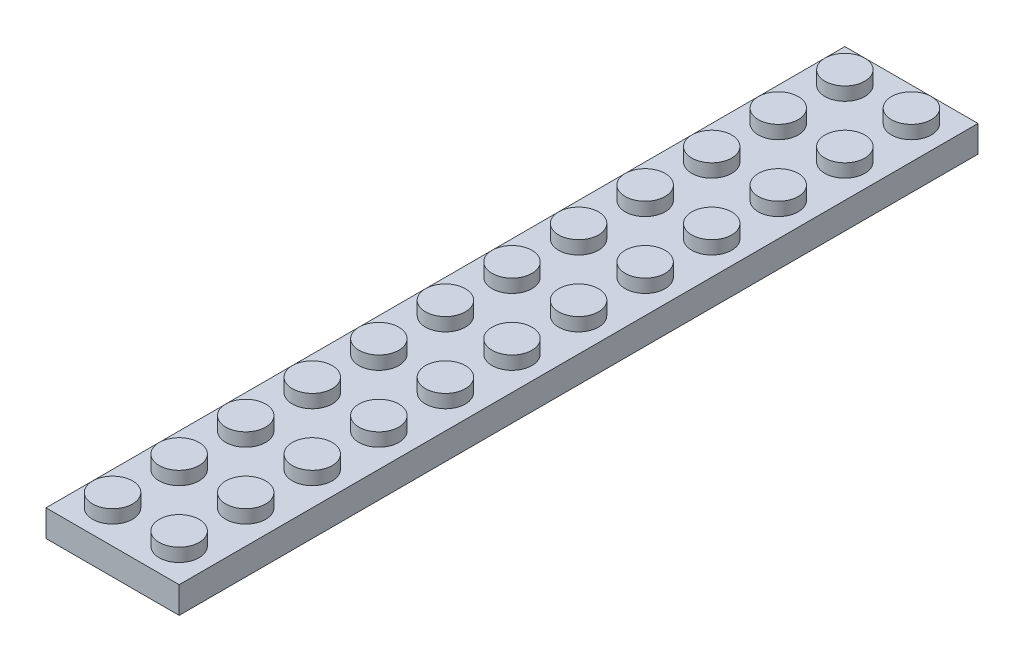
from build123d import *

# Parameters (mm, degrees)
SKETCH1_W            = 16
SKETCH1_H            = 96
BOSS_EXTRUDE1_DEPTH  = 3.2
SKETCH2_R            = 2.4
BOSS_EXTRUDE2_DEPTH  = 1.6
LPATTERN1_COUNT      = 2
LPATTERN1_PITCH      = 8
LPATTERN1_COUNT_DIR2 = 12
LPATTERN1_PITCH_DIR2 = 8
SHELL1_T             = -1.6


with BuildPart() as part:
    # Sketch1 → Boss-Extrude1 (new body)
    with BuildSketch(Plane(origin=(0, 0, 0), x_dir=(1, 0, 0), z_dir=(0, 1, 0))):
        with Locations((8, 48)):
            Rectangle(SKETCH1_W, SKETCH1_H)
    extrude(amount=BOSS_EXTRUDE1_DEPTH)

    # Sketch2 → Boss-Extrude2 (add)
    with BuildSketch(Plane(origin=(0, 3.2, 0), x_dir=(1, 0, 0), z_dir=(0, 1, 0))):
        with Locations(Location((12, 4, 0), (0, 0, 90))):
            Circle(SKETCH2_R)
    boss_extrude2 = extrude(amount=BOSS_EXTRUDE2_DEPTH)

    # LPattern1: Boss-Extrude2 2 × 12
    with Locations(*[(-i * LPATTERN1_PITCH, 0, -j * LPATTERN1_PITCH_DIR2) for i in range(LPATTERN1_COUNT) for j in range(LPATTERN1_COUNT_DIR2) if (i, j) != (0, 0)]):
        add(boss_extrude2)

    # Shell1
    shell1_openings = [part.faces().sort_by_distance(p)[0] for p in [
        (8, 0, -48),
    ]]
    offset(amount=SHELL1_T, openings=shell1_openings, kind=Kind.INTERSECTION)


solid = part.part
